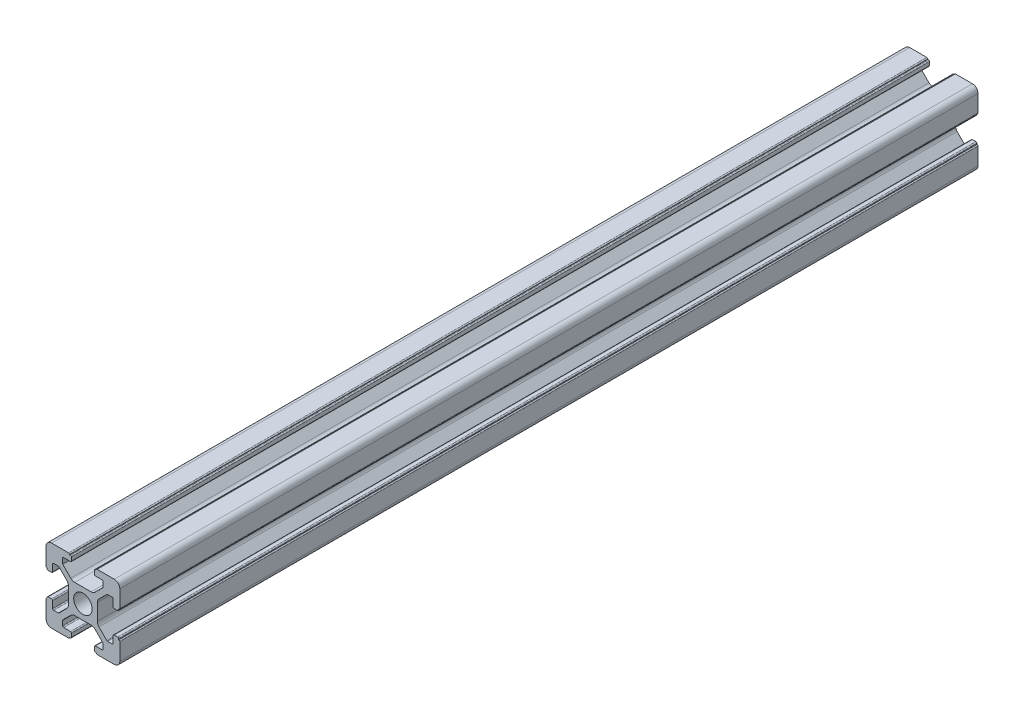
from build123d import *

# Parameters (mm, degrees)
CROQUIS3_R                = 2.5
PG20_T_SLOT_20X20_1_DEPTH = 232.5


with BuildPart() as part:
    # Croquis3 → Pg20_t_slot 20X20(1) (new body)
    with BuildSketch(Plane.XY):
        with BuildLine():
            Line((-2.218019485, 3.9), (2.218019485, 3.9))
            ThreePointArc((2.218019485, 3.9), (2.792044633, 4.014180701), (3.278679656, 4.339339828))
            Line((3.278679656, 4.339339828), (5.417989899, 6.478650071))
            ThreePointArc((5.417989899, 6.478650071), (5.478686269, 6.569488608), (5.5, 6.676639969))
            Line((5.5, 6.676639969), (5.5, 7.92))
            ThreePointArc((5.5, 7.92), (5.417989899, 8.117989899), (5.22, 8.2))
            Line((5.22, 8.2), (3.38, 8.2))
            ThreePointArc((3.38, 8.2), (3.182010101, 8.282010101), (3.1, 8.48))
            Line((3.1, 8.48), (3.1, 9.42))
            ThreePointArc((3.1, 9.42), (3.182010101, 9.617989899), (3.38, 9.7))
            Line((3.38, 9.7), (3.6, 9.7))
            Line((3.6, 9.7), (3.6, 9.72))
            ThreePointArc((3.6, 9.72), (3.682010101, 9.917989899), (3.88, 10))
            Line((3.88, 10), (8.5, 10))
            ThreePointArc((8.5, 10), (9.560660172, 9.560660172), (10, 8.5))
            Line((10, 8.5), (10, 3.88))
            ThreePointArc((10, 3.88), (9.917989899, 3.682010101), (9.72, 3.6))
            Line((9.72, 3.6), (9.7, 3.6))
            Line((9.7, 3.6), (9.7, 3.38))
            ThreePointArc((9.7, 3.38), (9.617989899, 3.182010101), (9.42, 3.1))
            Line((9.42, 3.1), (8.48, 3.1))
            ThreePointArc((8.48, 3.1), (8.282010101, 3.182010101), (8.2, 3.38))
            Line((8.2, 3.38), (8.2, 5.22))
            ThreePointArc((8.2, 5.22), (8.117989899, 5.417989899), (7.92, 5.5))
            Line((7.92, 5.5), (6.676639969, 5.5))
            ThreePointArc((6.676639969, 5.5), (6.569488608, 5.478686269), (6.478650071, 5.417989899))
            Line((6.478650071, 5.417989899), (4.339339828, 3.278679656))
            ThreePointArc((4.339339828, 3.278679656), (4.014180701, 2.792044633), (3.9, 2.218019485))
            Line((3.9, 2.218019485), (3.9, -2.218019485))
            ThreePointArc((3.9, -2.218019485), (4.014180701, -2.792044633), (4.339339828, -3.278679656))
            Line((4.339339828, -3.278679656), (6.478650071, -5.417989899))
            ThreePointArc((6.478650071, -5.417989899), (6.569488608, -5.478686269), (6.676639969, -5.5))
            Line((6.676639969, -5.5), (7.92, -5.5))
            ThreePointArc((7.92, -5.5), (8.117989899, -5.417989899), (8.2, -5.22))
            Line((8.2, -5.22), (8.2, -3.38))
            ThreePointArc((8.2, -3.38), (8.282010101, -3.182010101), (8.48, -3.1))
            Line((8.48, -3.1), (9.42, -3.1))
            ThreePointArc((9.42, -3.1), (9.617989899, -3.182010101), (9.7, -3.38))
            Line((9.7, -3.38), (9.7, -3.6))
            Line((9.7, -3.6), (9.72, -3.6))
            ThreePointArc((9.72, -3.6), (9.917989899, -3.682010101), (10, -3.88))
            Line((10, -3.88), (10, -8.5))
            ThreePointArc((10, -8.5), (9.560660172, -9.560660172), (8.5, -10))
            Line((8.5, -10), (3.88, -10))
            ThreePointArc((3.88, -10), (3.682010101, -9.917989899), (3.6, -9.72))
            Line((3.6, -9.72), (3.6, -9.7))
            Line((3.6, -9.7), (3.38, -9.7))
            ThreePointArc((3.38, -9.7), (3.182010101, -9.617989899), (3.1, -9.42))
            Line((3.1, -9.42), (3.1, -8.48))
            ThreePointArc((3.1, -8.48), (3.182010101, -8.282010101), (3.38, -8.2))
            Line((3.38, -8.2), (5.22, -8.2))
            ThreePointArc((5.22, -8.2), (5.417989899, -8.117989899), (5.5, -7.92))
            Line((5.5, -7.92), (5.5, -6.676639969))
            ThreePointArc((5.5, -6.676639969), (5.478686269, -6.569488608), (5.417989899, -6.478650071))
            Line((5.417989899, -6.478650071), (3.278679656, -4.339339828))
            ThreePointArc((3.278679656, -4.339339828), (2.792044633, -4.014180701), (2.218019485, -3.9))
            Line((2.218019485, -3.9), (-2.218019485, -3.9))
            ThreePointArc((-2.218019485, -3.9), (-2.792044633, -4.014180701), (-3.278679656, -4.339339828))
            Line((-3.278679656, -4.339339828), (-5.417989899, -6.478650071))
            ThreePointArc((-5.417989899, -6.478650071), (-5.478686269, -6.569488608), (-5.5, -6.676639969))
            Line((-5.5, -6.676639969), (-5.5, -7.92))
            ThreePointArc((-5.5, -7.92), (-5.417989899, -8.117989899), (-5.22, -8.2))
            Line((-5.22, -8.2), (-3.38, -8.2))
            ThreePointArc((-3.38, -8.2), (-3.182010101, -8.282010101), (-3.1, -8.48))
            Line((-3.1, -8.48), (-3.1, -9.42))
            ThreePointArc((-3.1, -9.42), (-3.182010101, -9.617989899), (-3.38, -9.7))
            Line((-3.38, -9.7), (-3.6, -9.7))
            Line((-3.6, -9.7), (-3.6, -9.72))
            ThreePointArc((-3.6, -9.72), (-3.682010101, -9.917989899), (-3.88, -10))
            Line((-3.88, -10), (-8.5, -10))
            ThreePointArc((-8.5, -10), (-9.560660172, -9.560660172), (-10, -8.5))
            Line((-10, -8.5), (-10, -3.88))
            ThreePointArc((-10, -3.88), (-9.917989899, -3.682010101), (-9.72, -3.6))
            Line((-9.72, -3.6), (-9.7, -3.6))
            Line((-9.7, -3.6), (-9.7, -3.38))
            ThreePointArc((-9.7, -3.38), (-9.617989899, -3.182010101), (-9.42, -3.1))
            Line((-9.42, -3.1), (-8.48, -3.1))
            ThreePointArc((-8.48, -3.1), (-8.282010101, -3.182010101), (-8.2, -3.38))
            Line((-8.2, -3.38), (-8.2, -5.22))
            ThreePointArc((-8.2, -5.22), (-8.117989899, -5.417989899), (-7.92, -5.5))
            Line((-7.92, -5.5), (-6.676639969, -5.5))
            ThreePointArc((-6.676639969, -5.5), (-6.569488608, -5.478686269), (-6.478650071, -5.417989899))
            Line((-6.478650071, -5.417989899), (-4.339339828, -3.278679656))
            ThreePointArc((-4.339339828, -3.278679656), (-4.014180701, -2.792044633), (-3.9, -2.218019485))
            Line((-3.9, -2.218019485), (-3.9, 2.218019485))
            ThreePointArc((-3.9, 2.218019485), (-4.014180701, 2.792044633), (-4.339339828, 3.278679656))
            Line((-4.339339828, 3.278679656), (-6.478650071, 5.417989899))
            ThreePointArc((-6.478650071, 5.417989899), (-6.569488608, 5.478686269), (-6.676639969, 5.5))
            Line((-6.676639969, 5.5), (-7.92, 5.5))
            ThreePointArc((-7.92, 5.5), (-8.117989899, 5.417989899), (-8.2, 5.22))
            Line((-8.2, 5.22), (-8.2, 3.38))
            ThreePointArc((-8.2, 3.38), (-8.282010101, 3.182010101), (-8.48, 3.1))
            Line((-8.48, 3.1), (-9.42, 3.1))
            ThreePointArc((-9.42, 3.1), (-9.617989899, 3.182010101), (-9.7, 3.38))
            Line((-9.7, 3.38), (-9.7, 3.6))
            Line((-9.7, 3.6), (-9.72, 3.6))
            ThreePointArc((-9.72, 3.6), (-9.917989899, 3.682010101), (-10, 3.88))
            Line((-10, 3.88), (-10, 8.5))
            ThreePointArc((-10, 8.5), (-9.560660172, 9.560660172), (-8.5, 10))
            Line((-8.5, 10), (-3.88, 10))
            ThreePointArc((-3.88, 10), (-3.682010101, 9.917989899), (-3.6, 9.72))
            Line((-3.6, 9.72), (-3.6, 9.7))
            Line((-3.6, 9.7), (-3.38, 9.7))
            ThreePointArc((-3.38, 9.7), (-3.182010101, 9.617989899), (-3.1, 9.42))
            Line((-3.1, 9.42), (-3.1, 8.48))
            ThreePointArc((-3.1, 8.48), (-3.182010101, 8.282010101), (-3.38, 8.2))
            Line((-3.38, 8.2), (-5.22, 8.2))
            ThreePointArc((-5.22, 8.2), (-5.417989899, 8.117989899), (-5.5, 7.92))
            Line((-5.5, 7.92), (-5.5, 6.676639969))
            ThreePointArc((-5.5, 6.676639969), (-5.478686269, 6.569488608), (-5.417989899, 6.478650071))
            Line((-5.417989899, 6.478650071), (-3.278679656, 4.339339828))
            ThreePointArc((-3.278679656, 4.339339828), (-2.792044633, 4.014180701), (-2.218019485, 3.9))
        make_face()
        Circle(CROQUIS3_R, mode=Mode.SUBTRACT)
    extrude(amount=PG20_T_SLOT_20X20_1_DEPTH)


solid = part.part
